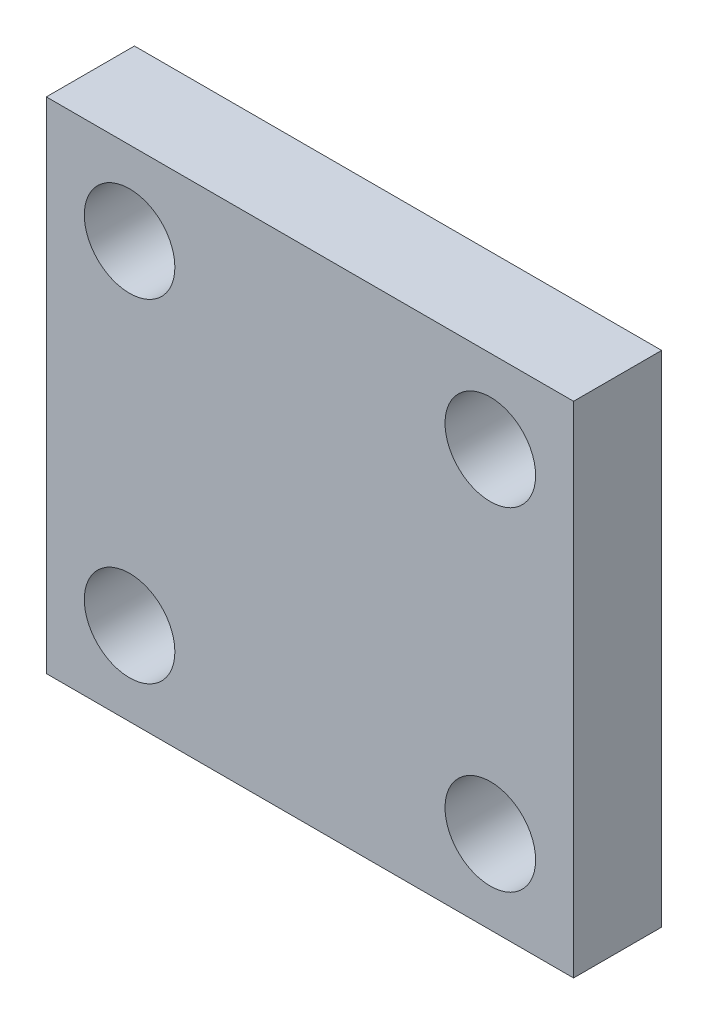
from build123d import *

# Parameters (mm, degrees)
SKETCH1_W               = 38
SKETCH1_H               = 36
BOSS_EXTRUDE1_DEPTH     = 6.35
F_1_4_CLEARANCE_HOLE1_D = 6.5278


with BuildPart() as part:
    # Sketch1 → Boss-Extrude1 (new body)
    with BuildSketch(Plane.XY):
        with Locations((19, 18)):
            Rectangle(SKETCH1_W, SKETCH1_H)
    extrude(amount=BOSS_EXTRUDE1_DEPTH)

    # 1/4 Clearance Hole1 (through all)
    with Locations(Plane.XY.offset(6.35)):
        with Locations((6, 30), (6, 6), (32, 6), (32, 30)):
            Hole(F_1_4_CLEARANCE_HOLE1_D / 2)


solid = part.part
